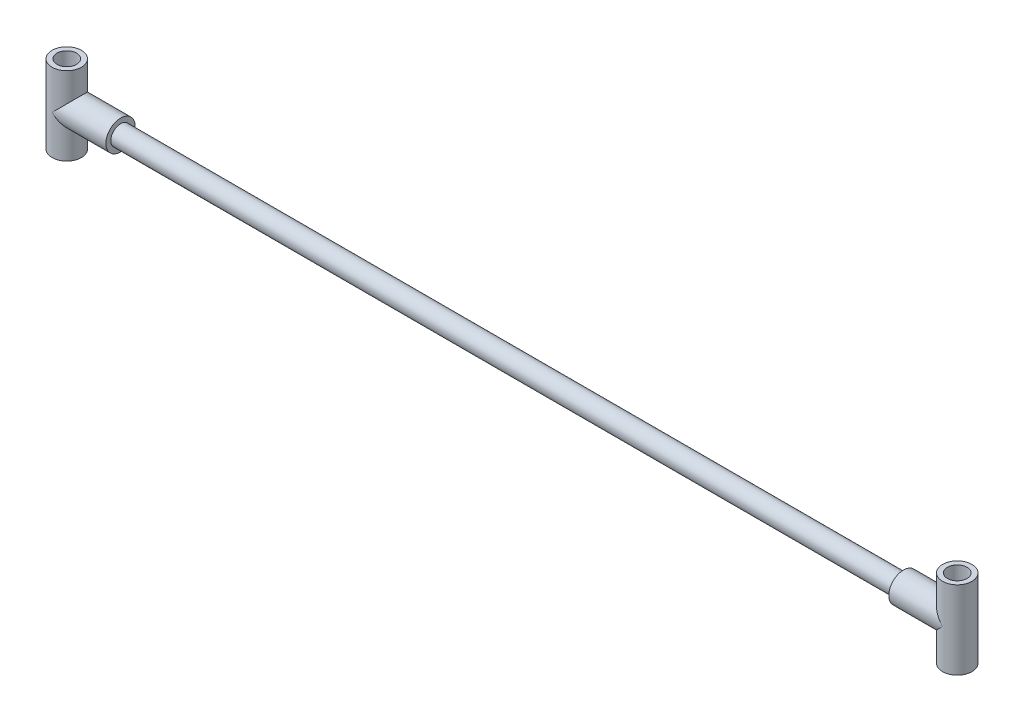
from build123d import *

# Parameters (mm, degrees)
SKETCH1_R             = 5
BOSS_EXTRUDE1_DEPTH   = 200
SKETCH2_R             = 7.5
BOSS_EXTRUDE2_DEPTH   = 20
BOSS_EXTRUDE2_2_DEPTH = 20
SKETCH3_R             = 7.5
BOSS_EXTRUDE3_DEPTH   = 27.5
BOSS_EXTRUDE4_START   = 27.5
SKETCH4_R             = 7.5
BOSS_EXTRUDE4_DEPTH   = 27.5
SKETCH5_R             = 5
CUT_EXTRUDE1_DEPTH    = 239.497903555


with BuildPart() as part:
    # Sketch1 → Boss-Extrude1 (new, symmetric)
    with BuildSketch(Plane(origin=(0, 0, 0), x_dir=(0, 0, -1), z_dir=(1, 0, 0))):
        Circle(SKETCH1_R)
    extrude(amount=BOSS_EXTRUDE1_DEPTH, both=True)



with BuildPart() as body_2:
    # Sketch2 → Boss-Extrude2 (new, symmetric)
    with BuildSketch(Plane(origin=(0, 0, 0), x_dir=(1, 0, 0), z_dir=(0, 1, 0))):
        with Locations(Location((227.5, 0, 0), (0, 0, 270))):
            Circle(SKETCH2_R)
    extrude(amount=BOSS_EXTRUDE2_DEPTH, both=True)


with BuildPart() as body_3:
    # Sketch2 → Boss-Extrude2 2 (new, symmetric)
    with BuildSketch(Plane(origin=(0, 0, 0), x_dir=(1, 0, 0), z_dir=(0, 1, 0))):
        with Locations(Location((-227.5, 0, 0), (0, 0, 90))):
            Circle(SKETCH2_R)
    extrude(amount=BOSS_EXTRUDE2_2_DEPTH, both=True)


with BuildPart() as part_1:
    add(part.part)

    add(body_3.part)  # Boss-Extrude3 merges body 3
    # Sketch3 → Boss-Extrude3 (add)
    with BuildSketch(Plane.ZY.offset(200)):
        Circle(SKETCH3_R)
    extrude(amount=BOSS_EXTRUDE3_DEPTH)


    add(body_2.part)  # Boss-Extrude4 merges body 2
    # Sketch4 → Boss-Extrude4 (add)
    with BuildSketch(Plane(origin=(200, 0, 0), x_dir=(0, 0, -1), z_dir=(1, 0, 0)).offset(BOSS_EXTRUDE4_START)):
        Circle(SKETCH4_R)
    extrude(amount=-BOSS_EXTRUDE4_DEPTH)

    # Sketch5 → Cut-Extrude1 (cut, through all)
    with BuildSketch(Plane(origin=(0, 20, 0), x_dir=(1, 0, 0), z_dir=(0, 1, 0))):
        with Locations(Location((227.5, 0, 0), (0, 0, 270))):
            Circle(SKETCH5_R)
        with Locations(Location((-227.5, 0, 0), (0, 0, 90))):
            Circle(SKETCH5_R)
    extrude(amount=-CUT_EXTRUDE1_DEPTH, mode=Mode.SUBTRACT)


solid = part_1.part
